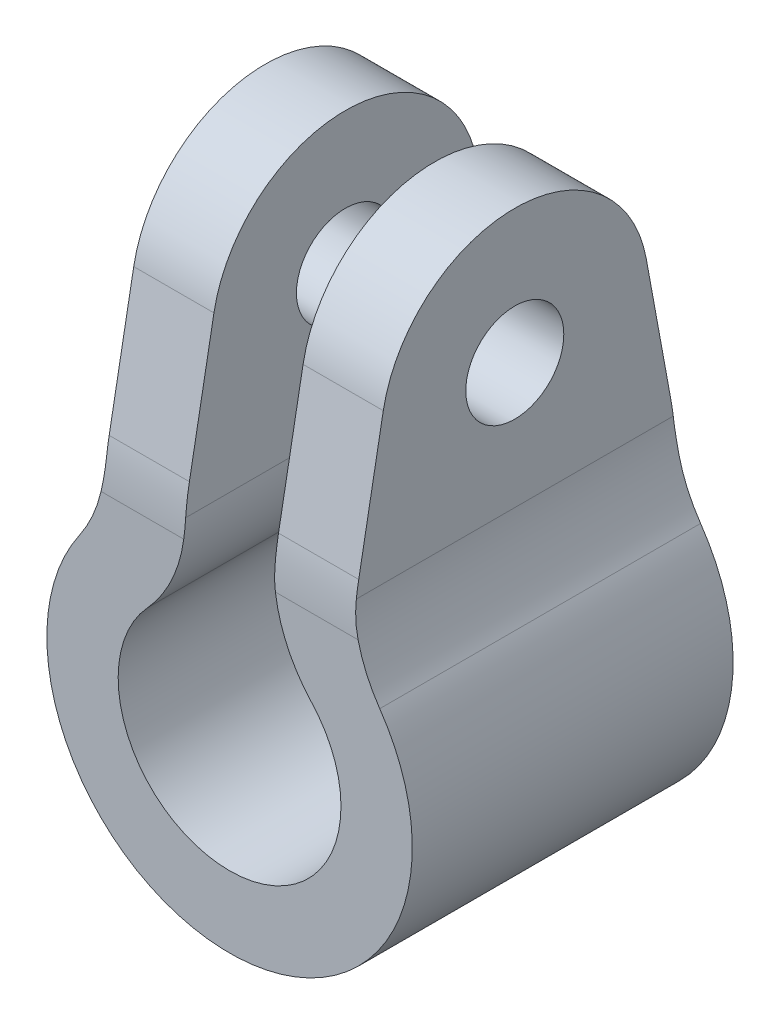
from build123d import *

# Parameters (mm, degrees)
BOSS_EXTRUDE1_DEPTH     = 9
SKETCH2_R               = 2.75
BOSS_EXTRUDE2_DEPTH     = 7
CUT_EXTRUDE1_DEPTH      = 33.420493986
CUT_EXTRUDE1_DEPTH_BACK = 33.420493986
FILLET1_R               = 8
FILLET2_R               = 15


with BuildPart() as part:
    # Sketch1 → Boss-Extrude1 (new, symmetric)
    with BuildSketch(Plane.XY):
        with BuildLine():
            Line((-2.5, 9.940447676), (-2.5, 5.728219619))
            ThreePointArc((-2.5, 5.728219619), (0, -6.25), (2.5, 5.728219619))
            Line((2.5, 5.728219619), (2.5, 9.940447676))
            ThreePointArc((2.5, 9.940447676), (0, -10.25), (-2.5, 9.940447676))
        make_face()
    extrude(amount=BOSS_EXTRUDE1_DEPTH, both=True)

    # Sketch2 → Boss-Extrude2 (add, symmetric)
    with BuildSketch(Plane(origin=(0, 0, 0), x_dir=(0, 0, -1), z_dir=(1, 0, 0))):
        with BuildLine():
            Line((-9, 9.940447676), (-7.37704918, 18.792906692))
            ThreePointArc((-7.37704918, 18.792906692), (0, 24.940447676), (7.37704918, 18.792906692))
            Line((7.37704918, 18.792906692), (9, 9.940447676))
            Line((9, 9.940447676), (9, -0.154776162))
            Line((9, -0.154776162), (-9, -0.154776162))
            Line((-9, -0.154776162), (-9, 9.940447676))
        make_face()
        with Locations((0, 17.440447676)):
            Circle(SKETCH2_R, mode=Mode.SUBTRACT)
    extrude(amount=BOSS_EXTRUDE2_DEPTH, both=True)

    # Sketch3 → Cut-Extrude1 (cut, two sides: drawn at the far end of the back side and taken through both)
    with BuildSketch(Plane.XY.offset(9).offset(-CUT_EXTRUDE1_DEPTH_BACK)):
        with BuildLine():
            Line((-2.5, 9.940447676), (-2.5, 24.940447676))
            Line((-2.5, 24.940447676), (2.5, 24.940447676))
            Line((2.5, 24.940447676), (2.5, 9.940447676))
            Line((2.5, 9.940447676), (2.5, 5.728219619))
            ThreePointArc((2.5, 5.728219619), (0, -6.25), (-2.5, 5.728219619))
            Line((-2.5, 5.728219619), (-2.5, 9.940447676))
        make_face()
    extrude(amount=CUT_EXTRUDE1_DEPTH + CUT_EXTRUDE1_DEPTH_BACK, mode=Mode.SUBTRACT)

    # Fillet1
    fillet1_edges = [part.edges().sort_by_distance(p)[0] for p in [
        (-7, 7.487489566, 0),
        (7, 7.487489566, 0),
        (-2.5, 5.728219619, 0),
        (2.5, 5.728219619, 0),
    ]]
    fillet(fillet1_edges, radius=FILLET1_R)

    # Fillet2
    fillet2_edges = [part.edges().sort_by_distance(p)[0] for p in [
        (-4.756470892, 9.940447676, 9),
        (4.756470892, 9.940447676, 9),
        (4.756470892, 9.940447676, -9),
        (-4.756470892, 9.940447676, -9),
    ]]
    fillet(fillet2_edges, radius=FILLET2_R)


solid = part.part
